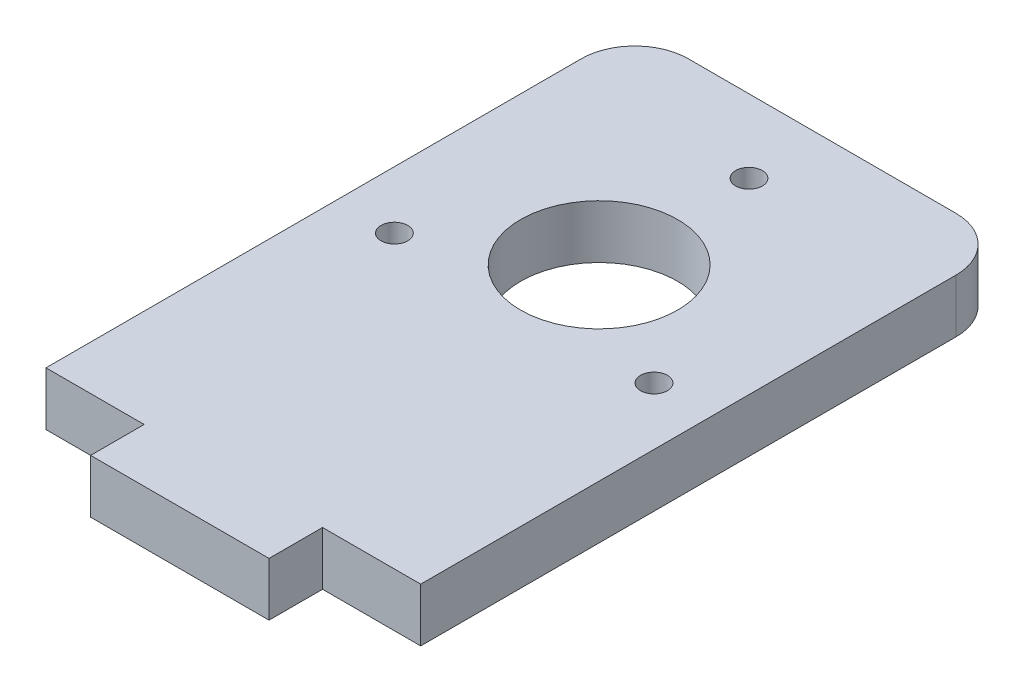
from build123d import *

# Parameters (mm, degrees)
ESQUISSE1_R        = 4.4
ESQUISSE1_R_2      = 0.75
BOSS_EXTRU_1_DEPTH = 3


with BuildPart() as part:
    # Esquisse1 → Boss.-Extru.1 (new body)
    with BuildSketch(Plane(origin=(0, 0, 0), x_dir=(1, 0, 0), z_dir=(0, 1, 0))):
        with BuildLine():
            Line((-10.5, 3), (-5, 3))
            Line((-5, 3), (-5, 0))
            Line((-5, 0), (5, 0))
            Line((5, 0), (5, 3))
            Line((5, 3), (10.5, 3))
            Line((10.5, 3), (10.5, 33))
            ThreePointArc((10.5, 33), (9.621320344, 35.121320344), (7.5, 36))
            Line((7.5, 36), (-7.5, 36))
            ThreePointArc((-7.5, 36), (-9.621320344, 35.121320344), (-10.5, 33))
            Line((-10.5, 33), (-10.5, 3))
        make_face()
        with Locations(Location((0, 23.5, 0), (0, 0, 270))):
            Circle(ESQUISSE1_R, mode=Mode.SUBTRACT)
        with Locations(Location((0, 31.9, 0), (0, 0, 270))):
            Circle(ESQUISSE1_R_2, mode=Mode.SUBTRACT)
        with Locations(Location((7.274613392, 19.3, 0), (0, 0, 270))):
            Circle(ESQUISSE1_R_2, mode=Mode.SUBTRACT)
        with Locations(Location((-7.274613392, 19.3, 0), (0, 0, 270))):
            Circle(ESQUISSE1_R_2, mode=Mode.SUBTRACT)
    extrude(amount=BOSS_EXTRU_1_DEPTH)


solid = part.part
